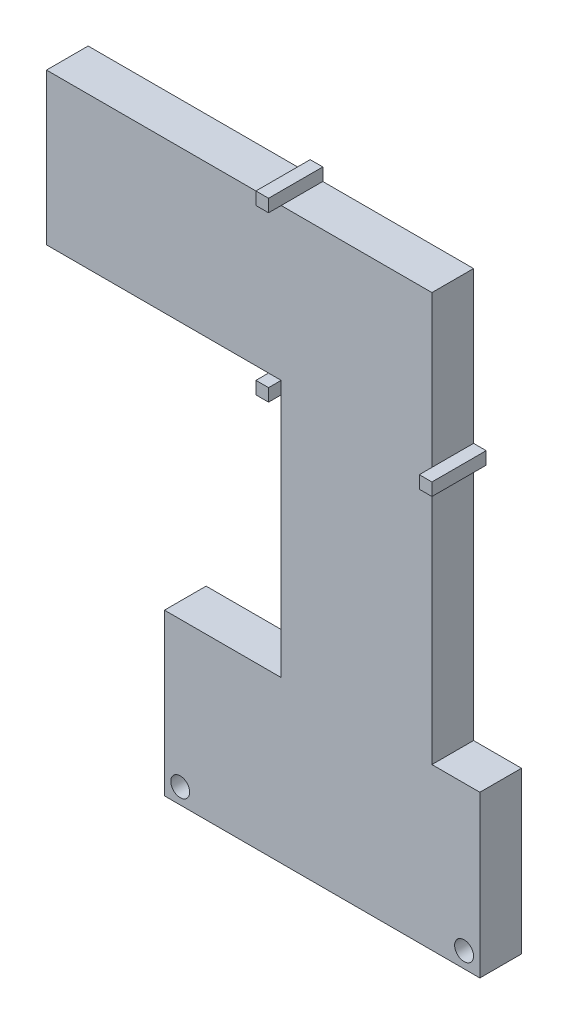
from build123d import *

# Parameters (mm, degrees)
IZIM1_R                     = 1.5
Y_KSEKLIK_EKSTR_ZYON1_DEPTH = 6.6
IZIM3_W                     = 2
IZIM3_H                     = 2
Y_KSEKLIK_EKSTR_ZYON3_DEPTH = 6.6
IZIM4_W                     = 2
IZIM4_H                     = 2
Y_KSEKLIK_EKSTR_ZYON4_DEPTH = 2


with BuildPart() as part:
    # Çizim1 → Yükseklik-Ekstrüzyon1 (new body)
    # profile 1 of 2: a face of its own
    with BuildSketch(Plane(origin=(0, 0, 0), x_dir=(0, 1, 0), z_dir=(0, 0, 1))):
        Polygon((0, 50), (0, 0), (25.5, 0), (25.5, 7.6), (25.5, 31.5), (25.5, 50), align=None)
        with Locations(Location((2.5, 2.5, 0), (0, 0, 270))):
            Circle(IZIM1_R, mode=Mode.SUBTRACT)
        with Locations(Location((2.5, 47.5, 0), (0, 0, 270))):
            Circle(IZIM1_R, mode=Mode.SUBTRACT)
    # profile 2 of 2: a face of its own
    with BuildSketch(Plane(origin=(0, 0, 0), x_dir=(0, 1, 0), z_dir=(0, 0, 1))):
        Polygon((25.5, 31.5), (25.5, 7.6), (90.3, 7.6), (90.3, 68.7), (66.3, 68.7), (66.3, 31.5), align=None)
    extrude(amount=Y_KSEKLIK_EKSTR_ZYON1_DEPTH)

    # Çizim3 → Yükseklik-Ekstrüzyon3 (add)
    with BuildSketch(Plane(origin=(0, 0, 0), x_dir=(0, 1, 0), z_dir=(0, 0, 1))):
        with Locations((65.3, 32.5)):
            Rectangle(IZIM3_W, IZIM3_H)
        with Locations((91.3, 32.5)):
            Rectangle(IZIM3_W, IZIM3_H)
        with Locations((65.3, 6.6)):
            Rectangle(IZIM3_W, IZIM3_H)
    extrude(amount=Y_KSEKLIK_EKSTR_ZYON3_DEPTH)

    # Çizim4 → Yükseklik-Ekstrüzyon4 (add)
    with BuildSketch(Plane.XY.offset(6.6)):
        with Locations((-32.5, 91.3)):
            Rectangle(IZIM4_W, IZIM4_H)
        with Locations((-32.5, 65.3)):
            Rectangle(IZIM4_W, IZIM4_H)
        with Locations((-6.6, 65.3)):
            Rectangle(IZIM4_W, IZIM4_H)
    extrude(amount=Y_KSEKLIK_EKSTR_ZYON4_DEPTH)


solid = part.part
